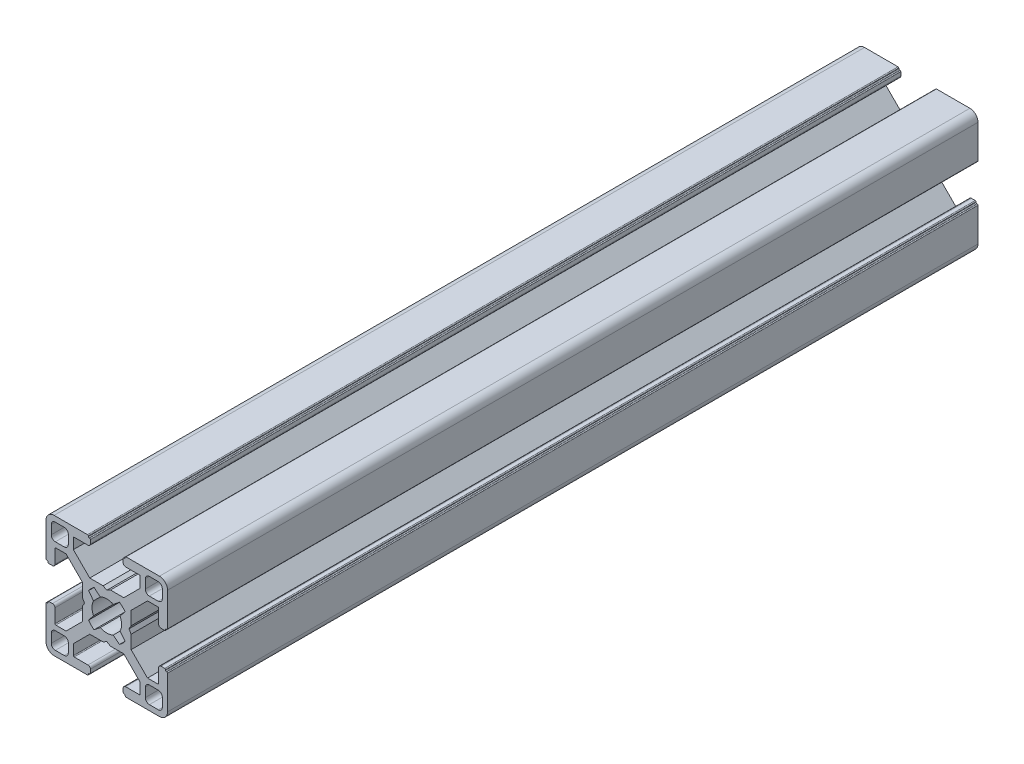
from build123d import *

# Parameters (mm, degrees)
BASE_EXTRUDE_DEPTH = 200


with BuildPart() as part:
    # Sketch1 → Base-Extrude (new body)
    with BuildSketch(Plane.XY):
        with BuildLine():
            Line((6.00446543, 0.899999619), (5.484852164, 0))
            Line((5.484852164, 0), (6.00446543, -0.899999619))
            Line((6.00446543, -0.899999619), (6.00446543, -4.204465866))
            Line((6.00446543, -4.204465866), (10.049999564, -8.25))
            Line((10.049999564, -8.25), (12.59999928, -8.25))
            ThreePointArc((12.59999928, -8.25), (12.741420837, -8.191421273), (12.799999564, -8.049999716))
            Line((12.799999564, -8.049999716), (12.799999564, -4.649999613))
            ThreePointArc((12.799999564, -4.649999613), (12.975735606, -4.225735278), (13.39999994, -4.049999237))
            Line((13.39999994, -4.049999237), (14.300000043, -4.049999237))
            ThreePointArc((14.300000043, -4.049999237), (14.4414216, -4.108577964), (14.500000327, -4.249999521))
            Line((14.500000327, -4.249999521), (14.500000327, -4.349998953))
            ThreePointArc((14.500000327, -4.349998953), (14.558579054, -4.49142051), (14.700000611, -4.549999237))
            Line((14.700000611, -4.549999237), (14.799999716, -4.549999237))
            ThreePointArc((14.799999716, -4.549999237), (14.941421273, -4.608577964), (15, -4.749999521))
            Line((15, -4.749999521), (15, -13.000000346))
            ThreePointArc((15, -13.000000346), (14.414213664, -14.414213664), (13.000000346, -15))
            Line((13.000000346, -15), (4.749999945, -15))
            ThreePointArc((4.749999945, -15), (4.60857832, -14.941421245), (4.549999564, -14.799999619))
            Line((4.549999564, -14.799999619), (4.549999564, -14.69999942))
            ThreePointArc((4.549999564, -14.69999942), (4.49142109, -14.558578474), (4.350000144, -14.5))
            Line((4.350000144, -14.5), (4.250000374, -14.5))
            ThreePointArc((4.250000374, -14.5), (4.108578753, -14.441421247), (4.05, -14.299999626))
            Line((4.05, -14.299999626), (4.05, -13.399999434))
            ThreePointArc((4.05, -13.399999434), (4.225735989, -12.975735226), (4.650000197, -12.799999237))
            Line((4.650000197, -12.799999237), (8.049999924, -12.799999237))
            ThreePointArc((8.049999924, -12.799999237), (8.191421565, -12.741420475), (8.250000327, -12.599998834))
            Line((8.250000327, -12.599998834), (8.250000327, -10.049999237))
            Line((8.250000327, -10.049999237), (4.204466193, -6))
            Line((4.204466193, -6), (0.899999946, -6))
            Line((0.899999946, -6), (0, -5.484851837))
            Line((0, -5.484851837), (-0.899999946, -6))
            Line((-0.899999946, -6), (-4.204466193, -6))
            Line((-4.204466193, -6), (-8.250000327, -10.049999237))
            Line((-8.250000327, -10.049999237), (-8.250000327, -12.599998834))
            ThreePointArc((-8.250000327, -12.599998834), (-8.191421565, -12.741420475), (-8.049999924, -12.799999237))
            Line((-8.049999924, -12.799999237), (-4.650000197, -12.799999237))
            ThreePointArc((-4.650000197, -12.799999237), (-4.225735989, -12.975735226), (-4.05, -13.399999434))
            Line((-4.05, -13.399999434), (-4.05, -14.299999626))
            ThreePointArc((-4.05, -14.299999626), (-4.108578753, -14.441421247), (-4.250000374, -14.5))
            Line((-4.250000374, -14.5), (-4.350000144, -14.5))
            ThreePointArc((-4.350000144, -14.5), (-4.49142109, -14.558578474), (-4.549999564, -14.69999942))
            Line((-4.549999564, -14.69999942), (-4.549999564, -14.799999619))
            ThreePointArc((-4.549999564, -14.799999619), (-4.60857832, -14.941421245), (-4.749999945, -15))
            Line((-4.749999945, -15), (-13.000000346, -15))
            ThreePointArc((-13.000000346, -15), (-14.414213664, -14.414213664), (-15, -13.000000346))
            Line((-15, -13.000000346), (-15, -4.749999521))
            ThreePointArc((-15, -4.749999521), (-14.941421273, -4.608577964), (-14.799999716, -4.549999237))
            Line((-14.799999716, -4.549999237), (-14.700000611, -4.549999237))
            ThreePointArc((-14.700000611, -4.549999237), (-14.558579054, -4.49142051), (-14.500000327, -4.349998953))
            Line((-14.500000327, -4.349998953), (-14.500000327, -4.249999521))
            ThreePointArc((-14.500000327, -4.249999521), (-14.4414216, -4.108577964), (-14.300000043, -4.049999237))
            Line((-14.300000043, -4.049999237), (-13.39999994, -4.049999237))
            ThreePointArc((-13.39999994, -4.049999237), (-12.975735606, -4.225735278), (-12.799999564, -4.649999613))
            Line((-12.799999564, -4.649999613), (-12.799999564, -8.049999716))
            ThreePointArc((-12.799999564, -8.049999716), (-12.741420837, -8.191421273), (-12.59999928, -8.25))
            Line((-12.59999928, -8.25), (-10.049999564, -8.25))
            Line((-10.049999564, -8.25), (-6.00446543, -4.204465866))
            Line((-6.00446543, -4.204465866), (-6.00446543, -0.899999619))
            Line((-6.00446543, -0.899999619), (-5.484852164, 0))
            Line((-5.484852164, 0), (-6.00446543, 0.899999619))
            Line((-6.00446543, 0.899999619), (-6.00446543, 4.204465866))
            Line((-6.00446543, 4.204465866), (-10.049999564, 8.25))
            Line((-10.049999564, 8.25), (-12.59999928, 8.25))
            ThreePointArc((-12.59999928, 8.25), (-12.741420837, 8.191421273), (-12.799999564, 8.049999716))
            Line((-12.799999564, 8.049999716), (-12.799999564, 4.649999613))
            ThreePointArc((-12.799999564, 4.649999613), (-12.975735606, 4.225735278), (-13.39999994, 4.049999237))
            Line((-13.39999994, 4.049999237), (-14.300000043, 4.049999237))
            ThreePointArc((-14.300000043, 4.049999237), (-14.4414216, 4.108577964), (-14.500000327, 4.249999521))
            Line((-14.500000327, 4.249999521), (-14.500000327, 4.349998953))
            ThreePointArc((-14.500000327, 4.349998953), (-14.558579054, 4.49142051), (-14.700000611, 4.549999237))
            Line((-14.700000611, 4.549999237), (-14.799999716, 4.549999237))
            ThreePointArc((-14.799999716, 4.549999237), (-14.941421273, 4.608577964), (-15, 4.749999521))
            Line((-15, 4.749999521), (-15, 13.000000346))
            ThreePointArc((-15, 13.000000346), (-14.414213664, 14.414213664), (-13.000000346, 15))
            Line((-13.000000346, 15), (-4.749999945, 15))
            ThreePointArc((-4.749999945, 15), (-4.60857832, 14.941421245), (-4.549999564, 14.799999619))
            Line((-4.549999564, 14.799999619), (-4.549999564, 14.69999942))
            ThreePointArc((-4.549999564, 14.69999942), (-4.49142109, 14.558578474), (-4.350000144, 14.5))
            Line((-4.350000144, 14.5), (-4.250000374, 14.5))
            ThreePointArc((-4.250000374, 14.5), (-4.108578753, 14.441421247), (-4.05, 14.299999626))
            Line((-4.05, 14.299999626), (-4.05, 13.399999434))
            ThreePointArc((-4.05, 13.399999434), (-4.225735989, 12.975735226), (-4.650000197, 12.799999237))
            Line((-4.650000197, 12.799999237), (-8.049999924, 12.799999237))
            ThreePointArc((-8.049999924, 12.799999237), (-8.191421565, 12.741420475), (-8.250000327, 12.599998834))
            Line((-8.250000327, 12.599998834), (-8.250000327, 10.049999237))
            Line((-8.250000327, 10.049999237), (-4.204466193, 6))
            Line((-4.204466193, 6), (-0.899999946, 6))
            Line((-0.899999946, 6), (0, 5.484851837))
            Line((0, 5.484851837), (0.899999946, 6))
            Line((0.899999946, 6), (4.204466193, 6))
            Line((4.204466193, 6), (8.250000327, 10.049999237))
            Line((8.250000327, 10.049999237), (8.250000327, 12.599998834))
            ThreePointArc((8.250000327, 12.599998834), (8.191421565, 12.741420475), (8.049999924, 12.799999237))
            Line((8.049999924, 12.799999237), (4.650000197, 12.799999237))
            ThreePointArc((4.650000197, 12.799999237), (4.225735989, 12.975735226), (4.05, 13.399999434))
            Line((4.05, 13.399999434), (4.05, 14.299999626))
            ThreePointArc((4.05, 14.299999626), (4.108578753, 14.441421247), (4.250000374, 14.5))
            Line((4.250000374, 14.5), (4.350000144, 14.5))
            ThreePointArc((4.350000144, 14.5), (4.49142109, 14.558578474), (4.549999564, 14.69999942))
            Line((4.549999564, 14.69999942), (4.549999564, 14.799999619))
            ThreePointArc((4.549999564, 14.799999619), (4.60857832, 14.941421245), (4.749999945, 15))
            Line((4.749999945, 15), (13.000000346, 15))
            ThreePointArc((13.000000346, 15), (14.414213664, 14.414213664), (15, 13.000000346))
            Line((15, 13.000000346), (15, 4.749999521))
            ThreePointArc((15, 4.749999521), (14.941421273, 4.608577964), (14.799999716, 4.549999237))
            Line((14.799999716, 4.549999237), (14.700000611, 4.549999237))
            ThreePointArc((14.700000611, 4.549999237), (14.558579054, 4.49142051), (14.500000327, 4.349998953))
            Line((14.500000327, 4.349998953), (14.500000327, 4.249999521))
            ThreePointArc((14.500000327, 4.249999521), (14.4414216, 4.108577964), (14.300000043, 4.049999237))
            Line((14.300000043, 4.049999237), (13.39999994, 4.049999237))
            ThreePointArc((13.39999994, 4.049999237), (12.975735606, 4.225735278), (12.799999564, 4.649999613))
            Line((12.799999564, 4.649999613), (12.799999564, 8.049999716))
            ThreePointArc((12.799999564, 8.049999716), (12.741420837, 8.191421273), (12.59999928, 8.25))
            Line((12.59999928, 8.25), (10.049999564, 8.25))
            Line((10.049999564, 8.25), (6.00446543, 4.204465866))
            Line((6.00446543, 4.204465866), (6.00446543, 0.899999619))
        make_face()
        with BuildLine():
            Line((13.70000109, 12.700000398), (13.70000109, 10.499999635))
            ThreePointArc((13.70000109, 10.499999635), (13.407107874, 9.792892851), (12.70000109, 9.499999635))
            Line((12.70000109, 9.499999635), (10.500000327, 9.499999635))
            ThreePointArc((10.500000327, 9.499999635), (9.792893543, 9.792892851), (9.500000327, 10.499999635))
            Line((9.500000327, 10.499999635), (9.500000327, 12.700000398))
            ThreePointArc((9.500000327, 12.700000398), (9.792893543, 13.407107182), (10.500000327, 13.700000398))
            Line((10.500000327, 13.700000398), (12.70000109, 13.700000398))
            ThreePointArc((12.70000109, 13.700000398), (13.407107874, 13.407107182), (13.70000109, 12.700000398))
        make_face(mode=Mode.SUBTRACT)
        with BuildLine():
            Line((3.135929412, 4.518400903), (1.600129524, 3.280561767))
            ThreePointArc((1.600129524, 3.280561767), (0, 3.65), (-1.600129524, 3.280561767))
            Line((-1.600129524, 3.280561767), (-3.135929412, 4.518400903))
            ThreePointArc((-3.135929412, 4.518400903), (-3.881002259, 3.897155561), (-4.505336892, 3.154669473))
            Line((-4.505336892, 3.154669473), (-3.280561732, 1.600129597))
            ThreePointArc((-3.280561732, 1.600129597), (-3.65, 0), (-3.280561732, -1.600129597))
            Line((-3.280561732, -1.600129597), (-4.505336892, -3.154669473))
            ThreePointArc((-4.505336892, -3.154669473), (-3.881002259, -3.897155561), (-3.135929412, -4.518400903))
            Line((-3.135929412, -4.518400903), (-1.600129524, -3.280561767))
            ThreePointArc((-1.600129524, -3.280561767), (0, -3.65), (1.600129524, -3.280561767))
            Line((1.600129524, -3.280561767), (3.135929412, -4.518400903))
            ThreePointArc((3.135929412, -4.518400903), (3.881002259, -3.897155561), (4.505336892, -3.154669473))
            Line((4.505336892, -3.154669473), (3.280561732, -1.600129597))
            ThreePointArc((3.280561732, -1.600129597), (3.65, 0), (3.280561732, 1.600129597))
            Line((3.280561732, 1.600129597), (4.505336892, 3.154669473))
            ThreePointArc((4.505336892, 3.154669473), (3.881002259, 3.897155561), (3.135929412, 4.518400903))
        make_face(mode=Mode.SUBTRACT)
        with BuildLine():
            Line((-13.70000109, -12.700000398), (-13.70000109, -10.499999635))
            ThreePointArc((-13.70000109, -10.499999635), (-13.407107874, -9.792892851), (-12.70000109, -9.499999635))
            Line((-12.70000109, -9.499999635), (-10.500000327, -9.499999635))
            ThreePointArc((-10.500000327, -9.499999635), (-9.792893543, -9.792892851), (-9.500000327, -10.499999635))
            Line((-9.500000327, -10.499999635), (-9.500000327, -12.700000398))
            ThreePointArc((-9.500000327, -12.700000398), (-9.792893543, -13.407107182), (-10.500000327, -13.700000398))
            Line((-10.500000327, -13.700000398), (-12.70000109, -13.700000398))
            ThreePointArc((-12.70000109, -13.700000398), (-13.407107874, -13.407107182), (-13.70000109, -12.700000398))
        make_face(mode=Mode.SUBTRACT)
        with BuildLine():
            Line((10.500000327, -13.700000398), (12.70000109, -13.700000398))
            ThreePointArc((12.70000109, -13.700000398), (13.407107874, -13.407107182), (13.70000109, -12.700000398))
            Line((13.70000109, -12.700000398), (13.70000109, -10.499999635))
            ThreePointArc((13.70000109, -10.499999635), (13.407107874, -9.792892851), (12.70000109, -9.499999635))
            Line((12.70000109, -9.499999635), (10.500000327, -9.499999635))
            ThreePointArc((10.500000327, -9.499999635), (9.792893543, -9.792892851), (9.500000327, -10.499999635))
            Line((9.500000327, -10.499999635), (9.500000327, -12.700000398))
            ThreePointArc((9.500000327, -12.700000398), (9.792893543, -13.407107182), (10.500000327, -13.700000398))
        make_face(mode=Mode.SUBTRACT)
        with BuildLine():
            Line((-10.500000327, 13.700000398), (-12.70000109, 13.700000398))
            ThreePointArc((-12.70000109, 13.700000398), (-13.407107874, 13.407107182), (-13.70000109, 12.700000398))
            Line((-13.70000109, 12.700000398), (-13.70000109, 10.499999635))
            ThreePointArc((-13.70000109, 10.499999635), (-13.407107874, 9.792892851), (-12.70000109, 9.499999635))
            Line((-12.70000109, 9.499999635), (-10.500000327, 9.499999635))
            ThreePointArc((-10.500000327, 9.499999635), (-9.792893543, 9.792892851), (-9.500000327, 10.499999635))
            Line((-9.500000327, 10.499999635), (-9.500000327, 12.700000398))
            ThreePointArc((-9.500000327, 12.700000398), (-9.792893543, 13.407107182), (-10.500000327, 13.700000398))
        make_face(mode=Mode.SUBTRACT)
    extrude(amount=-BASE_EXTRUDE_DEPTH)


solid = part.part
